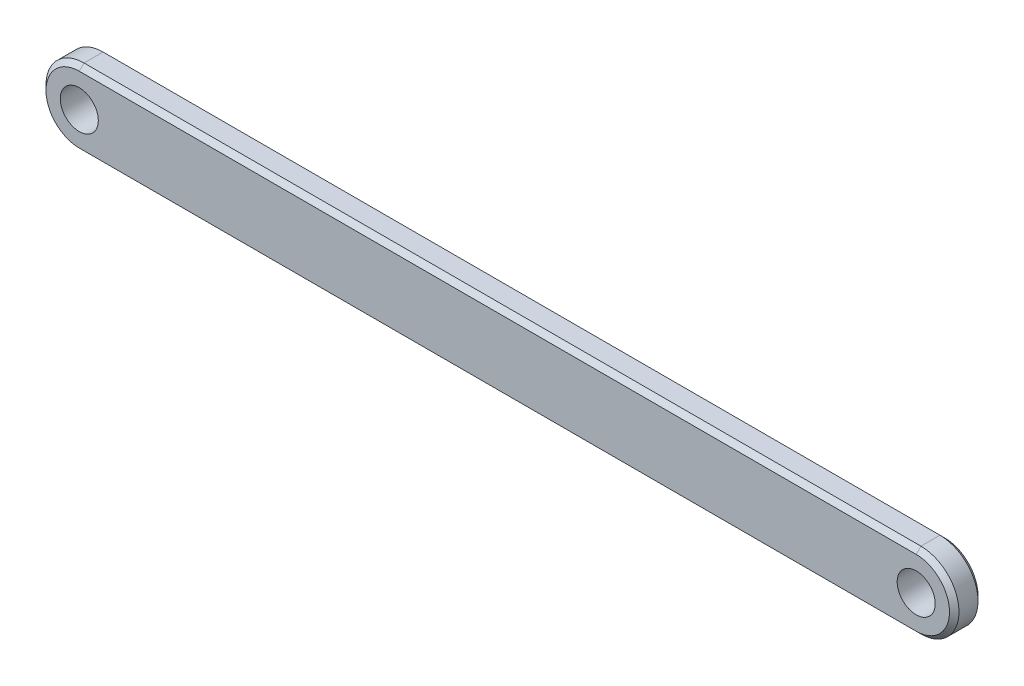
from build123d import *

# Parameters (mm, degrees)
SKETCH1_R           = 2
BOSS_EXTRUDE1_DEPTH = 1.5
CHAMFER1_SIZE       = 0.5


with BuildPart() as part:
    # Sketch1 → Boss-Extrude1 (new, symmetric)
    with BuildSketch(Plane.XY):
        with BuildLine():
            Line((44, -4), (-44, -4))
            ThreePointArc((-44, -4), (-48, 0), (-44, 4))
            Line((-44, 4), (44, 4))
            ThreePointArc((44, 4), (48, 0), (44, -4))
        make_face()
        with Locations((-44, 0)):
            Circle(SKETCH1_R, mode=Mode.SUBTRACT)
        with Locations((44, 0)):
            Circle(SKETCH1_R, mode=Mode.SUBTRACT)
    extrude(amount=BOSS_EXTRUDE1_DEPTH, both=True)

    # Chamfer1
    chamfer1_edges = [part.edges().sort_by_distance(p)[0] for p in [
        (-48, 0, 1.5),
        (0, -4, 1.5),
        (48, 0, 1.5),
        (0, -4, -1.5),
        (-48, 0, -1.5),
        (0, 4, -1.5),
        (48, 0, -1.5),
        (0, 4, 1.5),
    ]]
    chamfer(chamfer1_edges, length=CHAMFER1_SIZE)


solid = part.part
